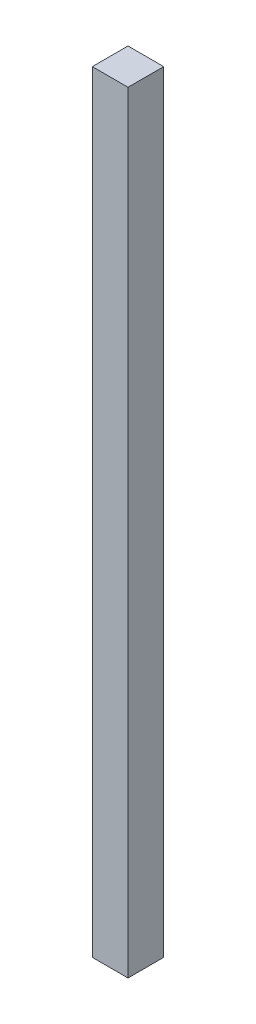
from build123d import *

# Parameters (mm, degrees)
SKETCH1_W           = 25
SKETCH1_H           = 25
BOSS_EXTRUDE1_DEPTH = 540


with BuildPart() as part:
    # Sketch1 → Boss-Extrude1 (new body)
    with BuildSketch(Plane(origin=(0, 0, 0), x_dir=(1, 0, 0), z_dir=(0, 1, 0))):
        with Locations((-12.5, -12.5)):
            Rectangle(SKETCH1_W, SKETCH1_H)
    extrude(amount=BOSS_EXTRUDE1_DEPTH)


solid = part.part
